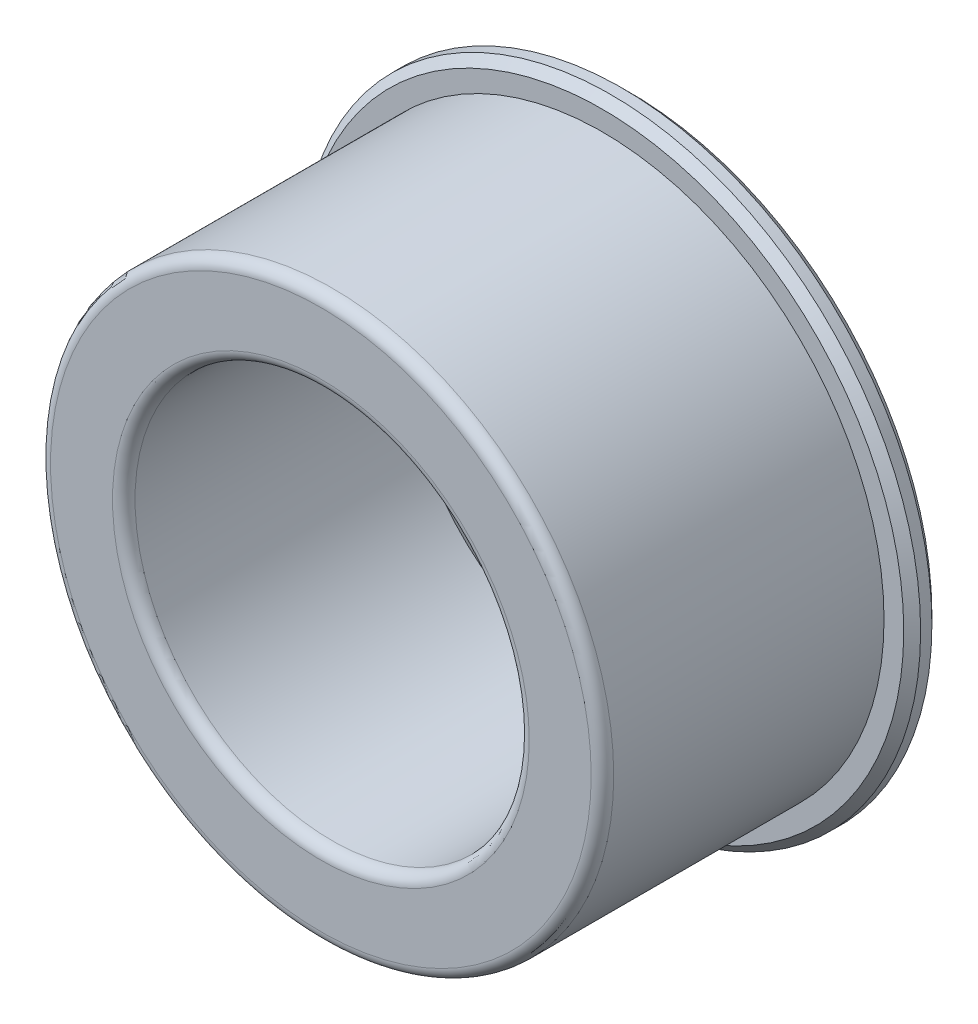
from build123d import *

# Parameters (mm, degrees)
SKETCH2_R           = 10
SKETCH2_R_2         = 7
BOSS_EXTRUDE1_DEPTH = 10
BOSS_EXTRUDE2_START = -1
SKETCH2_3_R         = 11
SKETCH2_3_R_2       = 7
BOSS_EXTRUDE2_DEPTH = 1
CHAMFER1_SIZE       = 0.3
CHAMFER2_SIZE       = 0.3
CHAMFER3_SIZE       = 1
FILLET1_R           = 0.4


with BuildPart() as part:
    # Sketch2 → Boss-Extrude1 (new body)
    with BuildSketch(Plane.XY):
        Circle(SKETCH2_R)
        Circle(SKETCH2_R_2, mode=Mode.SUBTRACT)
    extrude(amount=BOSS_EXTRUDE1_DEPTH)

    # Sketch2<3> → Boss-Extrude2 (add)
    with BuildSketch(Plane.XY.offset(BOSS_EXTRUDE2_START)):
        Circle(SKETCH2_3_R)
        Circle(SKETCH2_3_R_2, mode=Mode.SUBTRACT)
    extrude(amount=BOSS_EXTRUDE2_DEPTH)

    # Chamfer1
    chamfer1_edges = [part.edges().sort_by_distance(p)[0] for p in [
        (-11, 0, 0),
    ]]
    chamfer(chamfer1_edges, length=CHAMFER1_SIZE)

    # Chamfer2
    chamfer2_edges = [part.edges().sort_by_distance(p)[0] for p in [
        (-11, 0, -1),
    ]]
    chamfer(chamfer2_edges, length=CHAMFER2_SIZE)

    # Chamfer3
    chamfer3_edges = [part.edges().sort_by_distance(p)[0] for p in [
        (-7, 0, -1),
    ]]
    chamfer(chamfer3_edges, length=CHAMFER3_SIZE)

    # Fillet1
    fillet1_edges = [part.edges().sort_by_distance(p)[0] for p in [
        (-7, 0, 10),
        (-10, 0, 10),
    ]]
    fillet(fillet1_edges, radius=FILLET1_R)


solid = part.part
